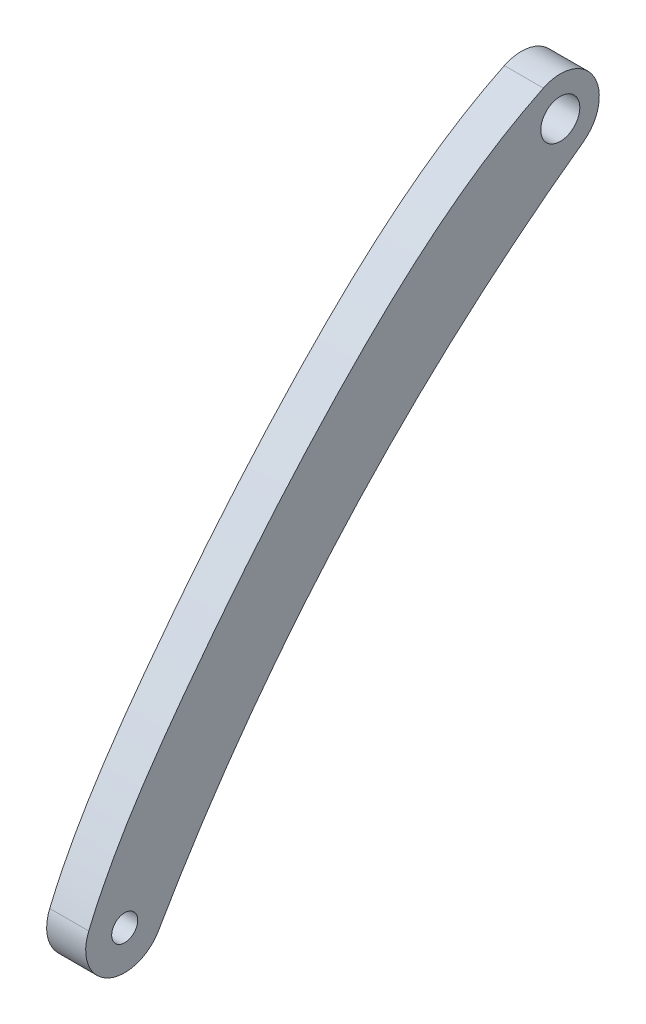
from build123d import *

# Parameters (mm, degrees)
SKETCH3_R               = 1.5
SKETCH3_R_2             = 1
BOSS_EXTRUDE2_DEPTH     = 3
SCALE1_SCALE            = 2
CUT_EXTRUDE1_DEPTH      = 236.835290083
CUT_EXTRUDE1_DEPTH_BACK = 236.835290083


with BuildPart() as part:
    # Sketch3 → Boss-Extrude2 (new body)
    with BuildSketch(Plane.YZ):
        with BuildLine():
            ThreePointArc((118.150026657, 100.656257205), (107.173519636, 113.210773098), (93.56234312, 122.845888539))
            ThreePointArc((93.56234312, 122.845888539), (81.890744338, 136.842623997), (100.108836706, 136.356895566))
            ThreePointArc((100.108836706, 136.356895566), (117.223173705, 124.346501771), (130.920746245, 108.550090897))
            ThreePointArc((130.920746245, 108.550090897), (133.266943269, 90.477177984), (118.150026657, 100.656257205))
        make_face()
        with Locations(Location((128.009104434, 98.9833599, 0), (0, 0, 270))):
            Circle(SKETCH3_R, mode=Mode.SUBTRACT)
        with Locations(Location((90.890008855, 132.482206797, 0), (0, 0, 270))):
            Circle(SKETCH3_R_2, mode=Mode.SUBTRACT)
    extrude(amount=BOSS_EXTRUDE2_DEPTH)


with BuildPart() as part_1:
    # Scale1: scaled about (1.5, 110.52343824, 117.054422993)
    add(part.part.scale(SCALE1_SCALE).moved(Location((-1.5, -110.52343824, -117.054422993))))

    # Sketch4 → Cut-Extrude1 (cut, two sides: drawn at the far end of the back side and taken through both)
    # profile 1 of 2: a face of its own
    with BuildSketch(Plane(origin=(-1.5, 0, 0), x_dir=(0, -1, 0), z_dir=(-1, 0, 0)).offset(-CUT_EXTRUDE1_DEPTH_BACK)):
        with BuildLine():
            ThreePointArc((-97.213316268, 162.951526918), (-130.622678549, 139.062399665), (-157.803069224, 108.271130585))
            ThreePointArc((-157.803069224, 108.271130585), (-161.544389081, 55.566493456), (-115.500216043, 81.48386945))
            ThreePointArc((-115.500216043, 81.48386945), (-97.123831652, 101.943304086), (-74.892452954, 118.131131925))
            ThreePointArc((-74.892452954, 118.131131925), (-44.402388035, 161.28356164), (-97.213316268, 162.951526918))
        make_face()
        with BuildLine():
            ThreePointArc((-125.776615074, 84.258091416), (-103.823601031, 109.367123202), (-76.601248, 128.637354084))
            ThreePointArc((-76.601248, 128.637354084), (-53.258050437, 156.630825002), (-89.694235172, 155.659368138))
            ThreePointArc((-89.694235172, 155.659368138), (-123.922909169, 131.638580549), (-151.318054249, 100.045758801))
            ThreePointArc((-151.318054249, 100.045758801), (-156.010448298, 63.899932976), (-125.776615074, 84.258091416))
        make_face(mode=Mode.SUBTRACT)
    # profile 2 of 2: a face of its own
    with BuildSketch(Plane(origin=(-1.5, 0, 0), x_dir=(0, -1, 0), z_dir=(-1, 0, 0)).offset(-CUT_EXTRUDE1_DEPTH_BACK)):
        with BuildLine():
            ThreePointArc((-151.318054249, 100.045758801), (-156.010448298, 63.899932976), (-125.776615074, 84.258091416))
            ThreePointArc((-125.776615074, 84.258091416), (-103.823601031, 109.367123202), (-76.601248, 128.637354084))
            ThreePointArc((-76.601248, 128.637354084), (-53.258050437, 156.630825002), (-89.694235172, 155.659368138))
            ThreePointArc((-89.694235172, 155.659368138), (-123.922909169, 131.638580549), (-151.318054249, 100.045758801))
        make_face()
        with BuildLine():
            ThreePointArc((-150.898316566, 83.520302039), (-148.562598659, 75.755899696), (-140.624556205, 77.407869396))
            ThreePointArc((-140.624556205, 77.407869396), (-107.93501235, 113.922858215), (-68.268560869, 142.706939107))
            ThreePointArc((-68.268560869, 142.706939107), (-65.87894024, 150.571004751), (-73.580432021, 153.441691001))
            add(Edge.make_bspline(
                [(-150.898316566, 83.520302039), (-145.205189888, 95.315934641), (-127.744788656, 114.843857064), (-100.777949871, 137.161096472), (-82.38983998, 149.740882267), (-73.580432021, 153.441691001)],
                knots=[0, 0, 0, 0, 0.370027271, 0.730223157, 1, 1, 1, 1], degree=3))
        make_face(mode=Mode.SUBTRACT)
    extrude(amount=CUT_EXTRUDE1_DEPTH + CUT_EXTRUDE1_DEPTH_BACK, mode=Mode.SUBTRACT)


solid = part_1.part
